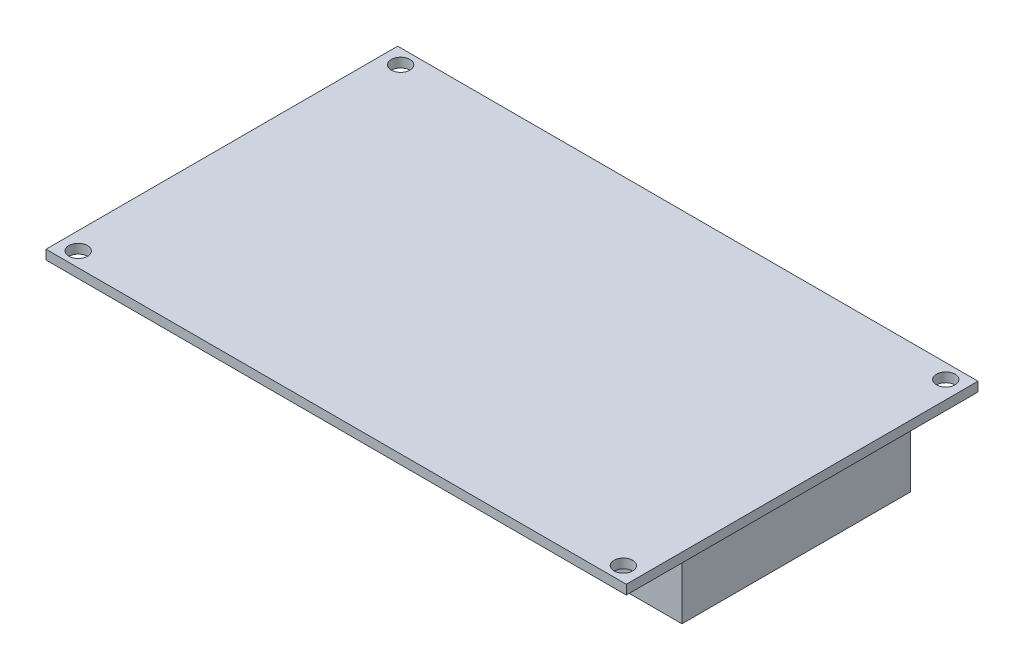
from build123d import *

# Parameters (mm, degrees)
SKETCH1_W           = 99
SKETCH1_H           = 60
BOSS_EXTRUDE1_DEPTH = 1.6
SKETCH2_R           = 1.5875
CUT_EXTRUDE1_DEPTH  = 58.903454128
SKETCH3_W           = 97
SKETCH3_H           = 39
BOSS_EXTRUDE2_DEPTH = 10
SKETCH4_W           = 71
SKETCH4_H           = 26
CUT_EXTRUDE2_DEPTH  = 0.5


with BuildPart() as part:
    # Sketch1 → Boss-Extrude1 (new body)
    with BuildSketch(Plane(origin=(0, 0, 0), x_dir=(1, 0, 0), z_dir=(0, 1, 0))):
        Rectangle(SKETCH1_W, SKETCH1_H)
    extrude(amount=BOSS_EXTRUDE1_DEPTH)

    # Sketch2 → Cut-Extrude1 (cut, through all)
    with BuildSketch(Plane.XZ):
        with Locations(Location((-46.5, 27.5, 0), (0, 0, 270))):
            Circle(SKETCH2_R)
        with Locations(Location((46.5, 27.5, 0), (0, 0, 270))):
            Circle(SKETCH2_R)
        with Locations(Location((46.5, -27.5, 0), (0, 0, 270))):
            Circle(SKETCH2_R)
        with Locations(Location((-46.5, -27.5, 0), (0, 0, 270))):
            Circle(SKETCH2_R)
    extrude(amount=-CUT_EXTRUDE1_DEPTH, mode=Mode.SUBTRACT)


with BuildPart() as body_2:
    # Sketch3 → Boss-Extrude2 (new body)
    with BuildSketch(Plane.XZ):
        Rectangle(SKETCH3_W, SKETCH3_H)
    extrude(amount=BOSS_EXTRUDE2_DEPTH)

    # Sketch4 → Cut-Extrude2 (cut)
    with BuildSketch(Plane.XZ.offset(10)):
        Rectangle(SKETCH4_W, SKETCH4_H)
    extrude(amount=-CUT_EXTRUDE2_DEPTH, mode=Mode.SUBTRACT)


solid = Compound([part.part, body_2.part])
